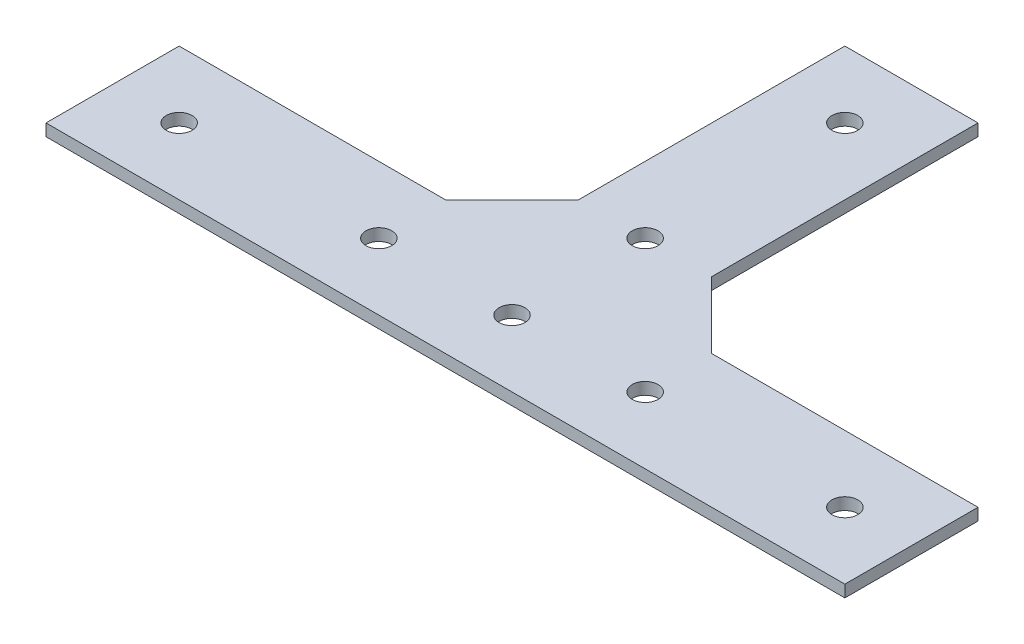
from build123d import *

# Parameters (mm, degrees)
BOSS_EXTRUDE1_DEPTH = 2.286
SKETCH3_R           = 2.4638
CUT_EXTRUDE2_DEPTH  = 126.744366856


with BuildPart() as part:
    # Sketch1 → Boss-Extrude1 (new body)
    with BuildSketch(Plane(origin=(0, 0, 0), x_dir=(1, 0, 0), z_dir=(0, 1, 0))):
        Polygon((25.4, 38.1), (38.1, 25.4), (88.9, 25.4), (88.9, 0), (0, 0), (0, 88.9), (25.4, 88.9), align=None)
    boss_extrude1 = extrude(amount=BOSS_EXTRUDE1_DEPTH)

    # Mirror1: Boss-Extrude1 across plane
    add(boss_extrude1.mirror(Plane.ZY.offset(-12.7)))

    # Sketch3 → Cut-Extrude2 (cut, through all)
    with BuildSketch(Plane(origin=(0, 2.286, 0), x_dir=(1, 0, 0), z_dir=(0, 1, 0))):
        with Locations(Location((76.2, 12.7, 0), (0, 0, 270))):
            Circle(SKETCH3_R)
        with Locations(Location((12.7, 12.7, 0), (0, 0, 270))):
            Circle(SKETCH3_R)
        with Locations(Location((12.7, 76.2, 0), (0, 0, 270))):
            Circle(SKETCH3_R)
        with Locations(Location((12.7, 38.1, 0), (0, 0, 270))):
            Circle(SKETCH3_R)
        with Locations(Location((38.1, 12.7, 0), (0, 0, 270))):
            Circle(SKETCH3_R)
    cut_extrude2 = extrude(amount=-CUT_EXTRUDE2_DEPTH, mode=Mode.SUBTRACT)

    # Mirror2: Cut-Extrude2 across plane
    add(cut_extrude2.mirror(Plane.ZY.offset(-12.7)), mode=Mode.SUBTRACT)


solid = part.part
